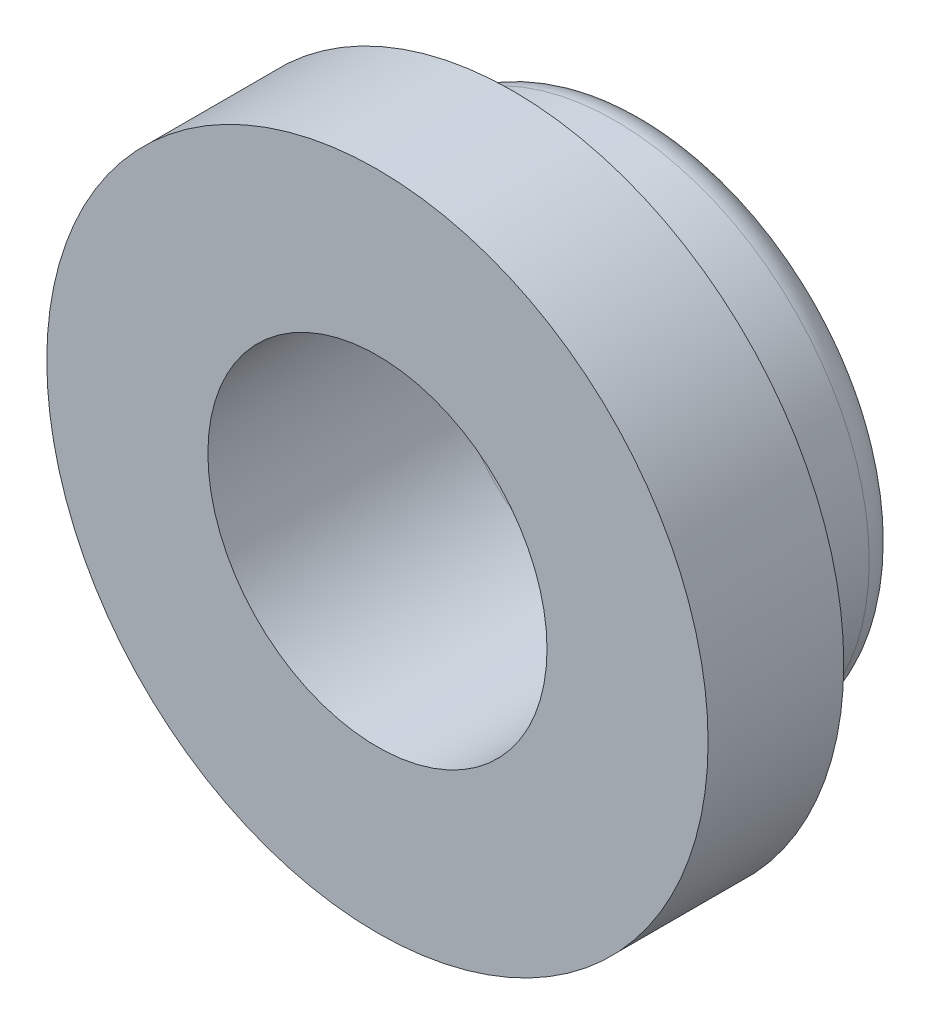
from build123d import *

# Parameters (mm, degrees)
SKETCH1_R           = 3.75
BOSS_EXTRUDE1_DEPTH = 4
SKETCH3_R           = 4.875
BOSS_EXTRUDE2_DEPTH = 2
SKETCH4_R           = 2.5
CUT_EXTRUDE1_DEPTH  = 8.970649283
FILLET1_R           = 0.5


with BuildPart() as part:
    # Sketch1 → Boss-Extrude1 (new body)
    with BuildSketch(Plane.XY):
        Circle(SKETCH1_R)
    extrude(amount=BOSS_EXTRUDE1_DEPTH)

    # Sketch3 → Boss-Extrude2 (add)
    with BuildSketch(Plane.XY.offset(4)):
        Circle(SKETCH3_R)
    extrude(amount=-BOSS_EXTRUDE2_DEPTH)

    # Sketch4 → Cut-Extrude1 (cut, through all)
    with BuildSketch(Plane.XY.offset(4)):
        Circle(SKETCH4_R)
    extrude(amount=-CUT_EXTRUDE1_DEPTH, mode=Mode.SUBTRACT)

    # Fillet1
    fillet1_edges = [part.edges().sort_by_distance(p)[0] for p in [
        (-2.5, 0, 0),
        (-3.75, 0, 0),
    ]]
    fillet(fillet1_edges, radius=FILLET1_R)


solid = part.part
